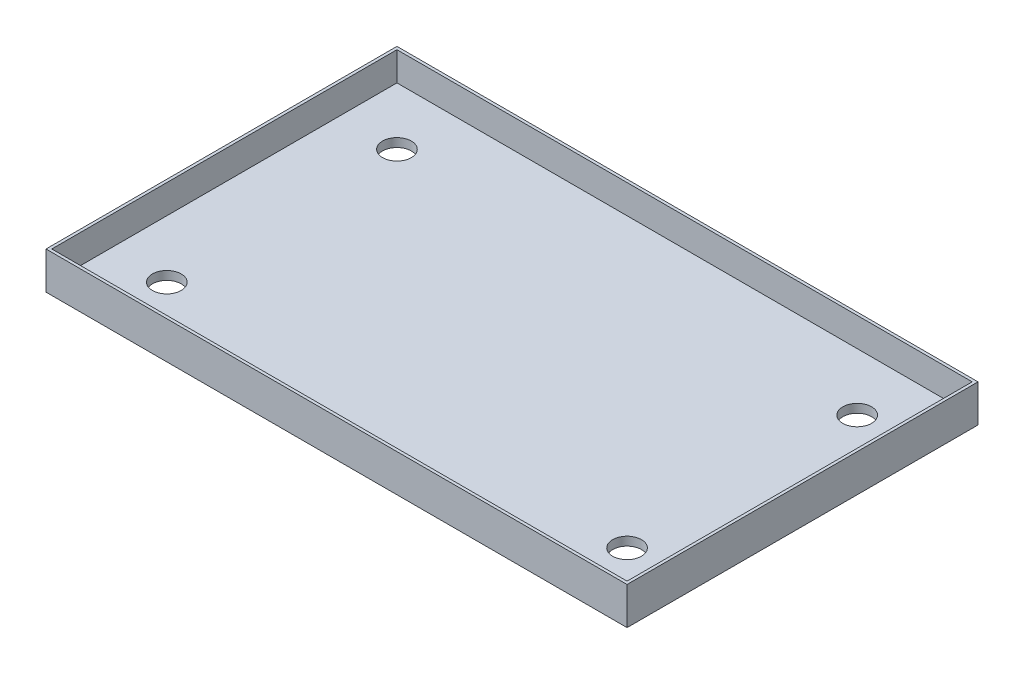
from build123d import *

# Parameters (mm, degrees)
SKETCH1_W           = 200
SKETCH1_H           = 120
SKETCH1_R           = 5
BOSS_EXTRUDE3_DEPTH = 1.5
SKETCH2_W           = 120
SKETCH2_H           = 13
BOSS_EXTRUDE4_DEPTH = 1
SKETCH3_W           = 202
SKETCH3_H           = 13
BOSS_EXTRUDE6_DEPTH = 1


with BuildPart() as part:
    # Sketch1 → Boss-Extrude3 (new, symmetric)
    with BuildSketch(Plane(origin=(0, 0, 0), x_dir=(1, 0, 0), z_dir=(0, 1, 0))):
        Rectangle(SKETCH1_W, SKETCH1_H)
        with Locations(Location((-80, 40, 0), (0, 0, 270))):
            Circle(SKETCH1_R, mode=Mode.SUBTRACT)
        with Locations(Location((80, 40, 0), (0, 0, 90))):
            Circle(SKETCH1_R, mode=Mode.SUBTRACT)
        with Locations(Location((80, -40, 0), (0, 0, 270))):
            Circle(SKETCH1_R, mode=Mode.SUBTRACT)
        with Locations(Location((-80, -40, 0), (0, 0, 90))):
            Circle(SKETCH1_R, mode=Mode.SUBTRACT)
    extrude(amount=BOSS_EXTRUDE3_DEPTH, both=True)

    # Sketch2 → Boss-Extrude4 (add)
    with BuildSketch(Plane.ZY.offset(100)):
        with Locations((0, 5)):
            Rectangle(SKETCH2_W, SKETCH2_H)
    boss_extrude4 = extrude(amount=BOSS_EXTRUDE4_DEPTH)

    # Mirror1: Boss-Extrude4 across plane
    add(boss_extrude4.mirror(Plane(origin=(0, 0, 0), x_dir=(0, 0, 1), z_dir=(1, 0, 0))))

    # Sketch3 → Boss-Extrude6 (add)
    with BuildSketch(Plane(origin=(0, 0, -60), x_dir=(-1, 0, 0), z_dir=(0, 0, -1))):
        with Locations((0, 5)):
            Rectangle(SKETCH3_W, SKETCH3_H)
    boss_extrude6 = extrude(amount=BOSS_EXTRUDE6_DEPTH)

    # Mirror2: Boss-Extrude6 across plane
    add(boss_extrude6.mirror(Plane.XY))


solid = part.part
